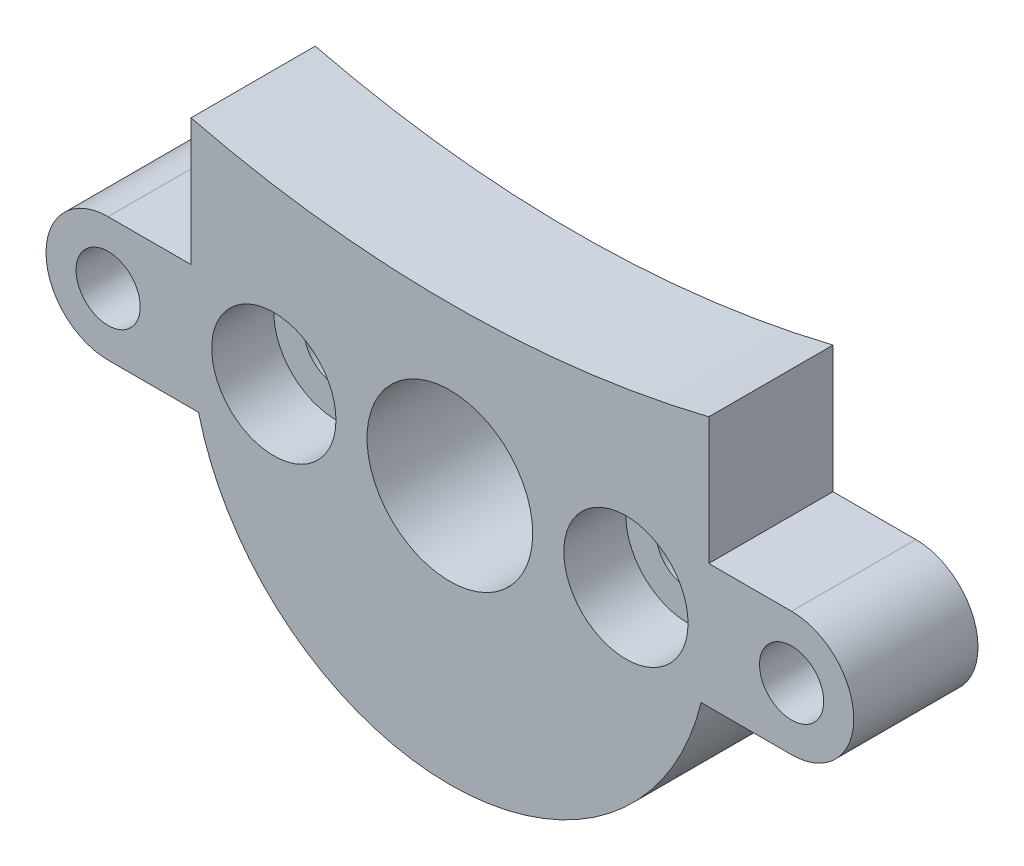
from build123d import *

# Parameters (mm, degrees)
SKETCH1_R           = 1.55
SKETCH1_R_2         = 4
BOSS_EXTRUDE1_DEPTH = 6
SKETCH2_R           = 3
CUT_EXTRUDE1_DEPTH  = 3


with BuildPart() as part:
    # Sketch1 → Boss-Extrude1 (new body)
    with BuildSketch(Plane.XY):
        with BuildLine():
            Line((-16.5, 3), (-12.5, 3))
            Line((-12.5, 3), (-12.5, 9.132525127))
            ThreePointArc((-12.5, 9.132525127), (0, 7.619182901), (12.5, 9.132525127))
            Line((12.5, 9.132525127), (12.5, 3))
            Line((12.5, 3), (16.5, 3))
            ThreePointArc((16.5, 3), (19.5, 0), (16.5, -3))
            Line((16.5, -3), (12.1346611, -3))
            ThreePointArc((12.1346611, -3), (0, -12.5), (-12.1346611, -3))
            Line((-12.1346611, -3), (-16.5, -3))
            ThreePointArc((-16.5, -3), (-19.5, 0), (-16.5, 3))
        make_face()
        with Locations((-8.5, 0)):
            Circle(SKETCH1_R, mode=Mode.SUBTRACT)
        with Locations((8.5, 0)):
            Circle(SKETCH1_R, mode=Mode.SUBTRACT)
        Circle(SKETCH1_R_2, mode=Mode.SUBTRACT)
        with Locations((-16.5, 0)):
            Circle(SKETCH1_R, mode=Mode.SUBTRACT)
        with Locations((16.5, 0)):
            Circle(SKETCH1_R, mode=Mode.SUBTRACT)
    extrude(amount=BOSS_EXTRUDE1_DEPTH)

    # Sketch2 → Cut-Extrude1 (cut)
    with BuildSketch(Plane.XY.offset(6)):
        with Locations((-8.5, 0)):
            Circle(SKETCH2_R)
        with Locations((8.5, 0)):
            Circle(SKETCH2_R)
    extrude(amount=-CUT_EXTRUDE1_DEPTH, mode=Mode.SUBTRACT)


solid = part.part
